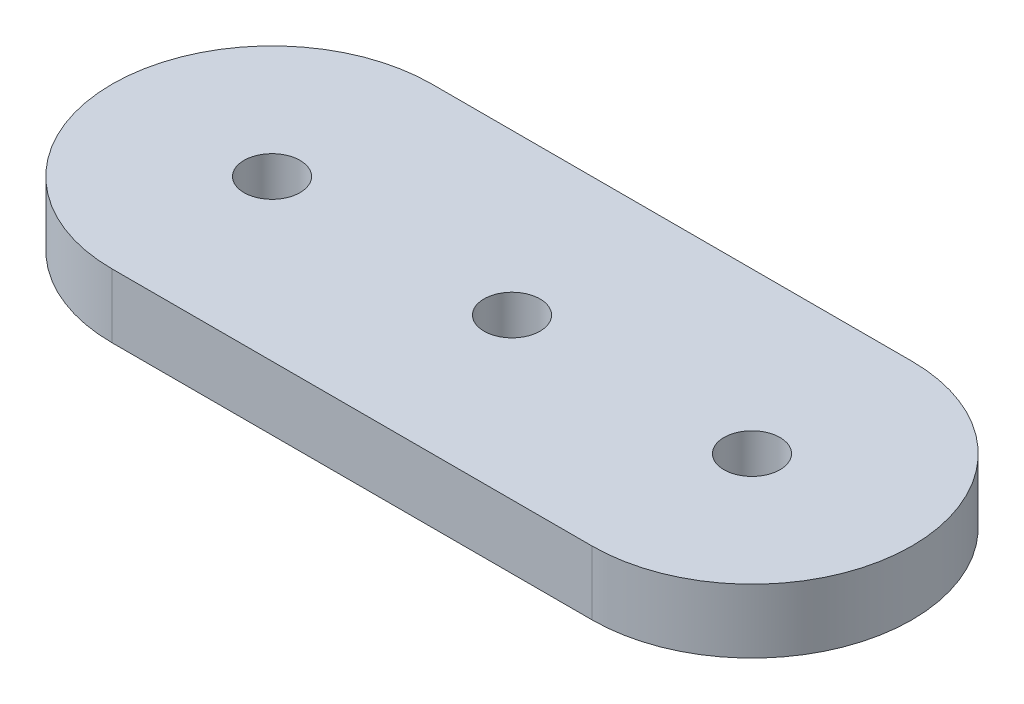
from build123d import *

# Parameters (mm, degrees)
SKETCH_1_R      = 1.75
EXTRUDE_1_DEPTH = 4


with BuildPart() as part:
    # Эскиз1 → Бобышка-Вытянуть1 (new body)
    with BuildSketch(Plane(origin=(0, 0, 0), x_dir=(1, 0, 0), z_dir=(0, 1, 0))):
        with BuildLine():
            Line((0, 10), (30, 10))
            ThreePointArc((30, 10), (40, 0), (30, -10))
            Line((30, -10), (0, -10))
            ThreePointArc((0, -10), (-10, 0), (0, 10))
        make_face()
        with Locations(Location((0, 0, 0), (0, 0, 270))):
            Circle(SKETCH_1_R, mode=Mode.SUBTRACT)
        with Locations(Location((30, 0, 0), (0, 0, 270))):
            Circle(SKETCH_1_R, mode=Mode.SUBTRACT)
        with Locations(Location((15, 0, 0), (0, 0, 270))):
            Circle(SKETCH_1_R, mode=Mode.SUBTRACT)
    extrude(amount=EXTRUDE_1_DEPTH)


solid = part.part
